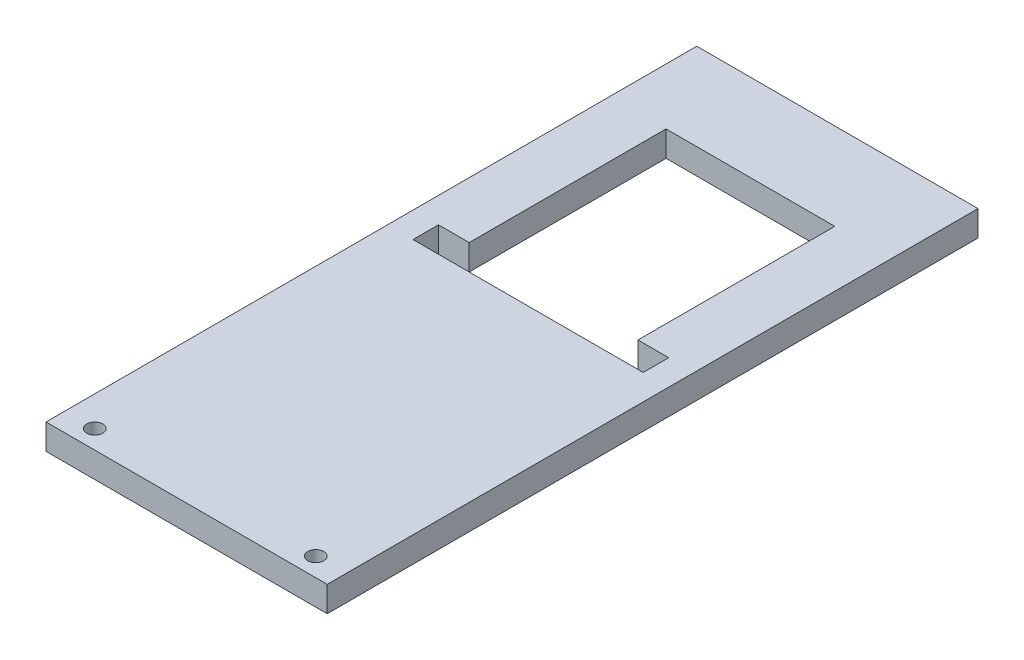
from build123d import *

# Parameters (mm, degrees)
BOSS_EXTRUDE1_DEPTH = 3.175
CUT_EXTRUDE1_DEPTH  = 204.138678001
SKETCH3_W           = 42
SKETCH3_H           = 55.35
SKETCH3_W_2         = 7.65
SKETCH3_H_2         = 6.35
CUT_EXTRUDE2_DEPTH  = 204.138678001
SKETCH5_R           = 2
CUT_EXTRUDE4_DEPTH  = 204.138678001


with BuildPart() as part:
    # Sketch1 → Boss-Extrude1 (new, symmetric)
    with BuildSketch(Plane(origin=(0, 0, 0), x_dir=(1, 0, 0), z_dir=(0, 1, 0))):
        with BuildLine():
            Line((35, -200), (35, 0))
            ThreePointArc((35, 0), (0, 35), (-35, 0))
            Line((-35, 0), (-35, -200))
            Line((-35, -200), (35, -200))
        make_face()
    extrude(amount=BOSS_EXTRUDE1_DEPTH, both=True)

    # Sketch2 → Cut-Extrude1 (cut, through all)
    with BuildSketch(Plane(origin=(0, 3.175, 0), x_dir=(1, 0, 0), z_dir=(0, 1, 0))):
        with BuildLine():
            Line((-35, -38), (35, -38))
            Line((35, -38), (35, 0))
            ThreePointArc((35, 0), (0, 35), (-35, 0))
            Line((-35, 0), (-35, -38))
        make_face()
    extrude(amount=-CUT_EXTRUDE1_DEPTH, mode=Mode.SUBTRACT)

    # Sketch3 → Cut-Extrude2 (cut, through all)
    with BuildSketch(Plane(origin=(0, 3.175, 0), x_dir=(1, 0, 0), z_dir=(0, 1, 0))):
        with Locations((0, -87.325)):
            Rectangle(SKETCH3_W, SKETCH3_H)
        with Locations((-24.825, -111.825)):
            Rectangle(SKETCH3_W_2, SKETCH3_H_2)
        with Locations((24.825, -111.825)):
            Rectangle(SKETCH3_W_2, SKETCH3_H_2)
    extrude(amount=-CUT_EXTRUDE2_DEPTH, mode=Mode.SUBTRACT)

    # Sketch5 → Cut-Extrude4 (cut, through all)
    with BuildSketch(Plane(origin=(0, 3.175, 0), x_dir=(1, 0, 0), z_dir=(0, 1, 0))):
        with Locations(Location((27.5, -195.35, 0), (0, 0, 270))):
            Circle(SKETCH5_R)
        with Locations(Location((-27.5, -195.35, 0), (0, 0, 270))):
            Circle(SKETCH5_R)
        with Locations((15, -65.35)):
            Circle(SKETCH5_R)
        with Locations((-15, -65.35)):
            Circle(SKETCH5_R)
    extrude(amount=-CUT_EXTRUDE4_DEPTH, mode=Mode.SUBTRACT)


solid = part.part
